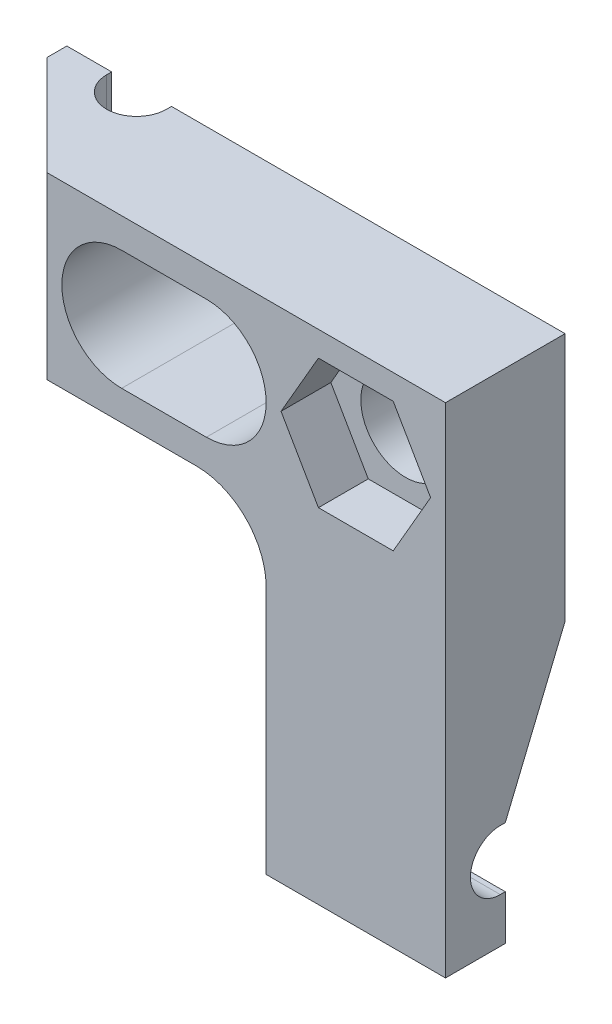
from build123d import *

# Parameters (mm, degrees)
SKIZZE2_R                       = 4.5
AUFSATZ_LINEAR_AUSTRAGEN1_DEPTH = 12
SCHNITT_LINEAR_AUSTRAGEN6_DEPTH = 5
SCHNITT_LINEAR_AUSTRAGEN1_DEPTH = 62.290292869
SCHNITT_LINEAR_AUSTRAGEN5_DEPTH = 62.290292869
SKIZZE6_W                       = 18
SKIZZE6_H                       = 25
SCHNITT_LINEAR_AUSTRAGEN7_DEPTH = 6
AUFSATZ_LINEAR_AUSTRAGEN2_DEPTH = 3
AUFSATZ_LINEAR_AUSTRAGEN3_DEPTH = 3
SCHNITT_LINEAR_AUSTRAGEN8_DEPTH = 62.290292869
FASE1_SIZE                      = 10


with BuildPart() as part:
    # Skizze2 → Aufsatz-Linear austragen1 (new body)
    with BuildSketch(Plane.XY):
        with BuildLine():
            Line((-7.5, 42.5), (-7.5, 24.5))
            Line((-7.5, 24.5), (17.5, 24.5))
            ThreePointArc((17.5, 24.5), (22.449747468, 22.449747468), (24.5, 17.5))
            Line((24.5, 17.5), (24.5, -7.5))
            Line((24.5, -7.5), (42.5, -7.5))
            Line((42.5, -7.5), (42.5, 42.5))
            Line((42.5, 42.5), (-7.5, 42.5))
        make_face()
        with Locations((33.5, 33.5)):
            Circle(SKIZZE2_R, mode=Mode.SUBTRACT)
    extrude(amount=AUFSATZ_LINEAR_AUSTRAGEN1_DEPTH)

    # Skizze5 → Schnitt-Linear austragen6 (cut)
    with BuildSketch(Plane.XY.offset(12)):
        Polygon((41.005553499, 33.5), (37.25277675, 40), (29.74722325, 40), (25.994446501, 33.5), (29.74722325, 27), (37.25277675, 27), align=None)
    extrude(amount=-SCHNITT_LINEAR_AUSTRAGEN6_DEPTH, mode=Mode.SUBTRACT)

    # Skizze3 → Schnitt-Linear austragen1 (cut, through all)
    with BuildSketch(Plane(origin=(0, 0, 0), x_dir=(1, 0, 0), z_dir=(0, 1, 0))):
        with BuildLine():
            Line((3, 4.576951254), (3, -0.5))
            ThreePointArc((3, -0.5), (0, -3.5), (-3, -0.5))
            Line((-3, -0.5), (-3, 4.576951254))
            ThreePointArc((-3, 4.576951254), (0, 7.576951254), (3, 4.576951254))
        make_face()
    extrude(amount=SCHNITT_LINEAR_AUSTRAGEN1_DEPTH, mode=Mode.SUBTRACT)

    # Skizze4 → Schnitt-Linear austragen5 (cut, through all)
    with BuildSketch(Plane(origin=(0, 0, 0), x_dir=(0, 0, -1), z_dir=(1, 0, 0))):
        with BuildLine():
            Line((-0.5, -3), (-6.5, -3))
            ThreePointArc((-6.5, -3), (-9.5, 0), (-6.5, 3))
            Line((-6.5, 3), (-0.5, 3))
            ThreePointArc((-0.5, 3), (2.5, 0), (-0.5, -3))
        make_face()
    extrude(amount=SCHNITT_LINEAR_AUSTRAGEN5_DEPTH, mode=Mode.SUBTRACT)

    # Skizze6 → Schnitt-Linear austragen7 (cut)
    with BuildSketch(Plane(origin=(0, 0, 0), x_dir=(-1, 0, 0), z_dir=(0, 0, -1))):
        with Locations((-33.5, 5)):
            Rectangle(SKIZZE6_W, SKIZZE6_H)
    extrude(amount=-SCHNITT_LINEAR_AUSTRAGEN7_DEPTH, mode=Mode.SUBTRACT)

    # Skizze7 → Aufsatz-Linear austragen2 (add)
    with BuildSketch(Plane(origin=(42.5, 0, 0), x_dir=(0, 0, -1), z_dir=(1, 0, 0))):
        Polygon((-6, 3), (-6, 17.5), (0, 17.5), align=None)
    extrude(amount=-AUFSATZ_LINEAR_AUSTRAGEN2_DEPTH)

    # Skizze8 → Aufsatz-Linear austragen3 (add)
    with BuildSketch(Plane.ZY.offset(-24.5)):
        Polygon((6, 3), (6, 17.5), (0, 17.5), align=None)
    extrude(amount=-AUFSATZ_LINEAR_AUSTRAGEN3_DEPTH)

    # Skizze9 → Schnitt-Linear austragen8 (cut, through all)
    with BuildSketch(Plane(origin=(0, 0, 0), x_dir=(-1, 0, 0), z_dir=(0, 0, -1))):
        with BuildLine():
            Line((-18.5, 39.5), (-10, 39.5))
            ThreePointArc((-10, 39.5), (-4, 33.5), (-10, 27.5))
            Line((-10, 27.5), (-18.5, 27.5))
            ThreePointArc((-18.5, 27.5), (-24.5, 33.5), (-18.5, 39.5))
        make_face()
    extrude(amount=-SCHNITT_LINEAR_AUSTRAGEN8_DEPTH, mode=Mode.SUBTRACT)

    # Fase1
    fase1_edges = [part.edges().sort_by_distance(p)[0] for p in [
        (-7.5, 33.5, 12),
    ]]
    chamfer(fase1_edges, length=FASE1_SIZE)


solid = part.part
